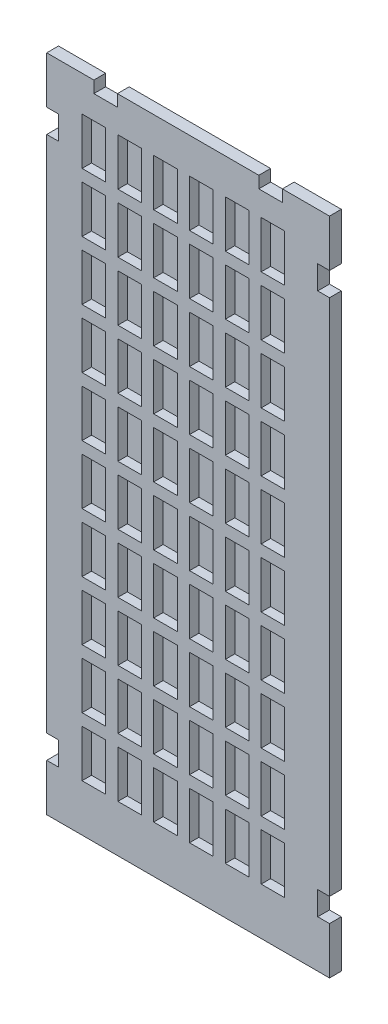
from build123d import *

# Parameters (mm, degrees)
BOSS_EXTRUDE1_DEPTH  = 3.175
SKETCH2_W            = 6.35
SKETCH2_H            = 12.7
CUT_EXTRUDE1_DEPTH   = 2.54
LPATTERN1_COUNT      = 6
LPATTERN1_PITCH      = 9.652
LPATTERN1_COUNT_DIR2 = 10
LPATTERN1_PITCH_DIR2 = 15.875


with BuildPart() as part:
    # Sketch1 → Boss-Extrude1 (new body)
    with BuildSketch(Plane.XY):
        Polygon((0, -177.8), (12.7, -177.8), (63.5, -177.8), (76.2, -177.8), (76.2, -165.1), (73.025, -165.1), (73.025, -158.75), (76.2, -158.75), (76.2, -19.05), (73.025, -19.05), (73.025, -12.7), (76.2, -12.7), (76.2, 0), (63.5, 0), (63.5, -3.175), (57.15, -3.175), (57.15, 0), (19.05, 0), (19.05, -3.175), (12.7, -3.175), (12.7, 0), (0, 0), (0, -12.7), (3.175, -12.7), (3.175, -19.05), (0, -19.05), (0, -158.75), (3.175, -158.75), (3.175, -165.1), (0, -165.1), align=None)
    extrude(amount=BOSS_EXTRUDE1_DEPTH)

    # Sketch2 → Cut-Extrude1 (cut)
    with BuildSketch(Plane.XY.offset(3.175)):
        with Locations((12.7, -15.875)):
            Rectangle(SKETCH2_W, SKETCH2_H)
    cut_extrude1 = extrude(amount=-CUT_EXTRUDE1_DEPTH, mode=Mode.SUBTRACT)

    # LPattern1: Cut-Extrude1 6 × 10
    with Locations(*[(i * LPATTERN1_PITCH, -j * LPATTERN1_PITCH_DIR2, 0) for i in range(LPATTERN1_COUNT) for j in range(LPATTERN1_COUNT_DIR2) if (i, j) != (0, 0)]):
        add(cut_extrude1, mode=Mode.SUBTRACT)


solid = part.part
